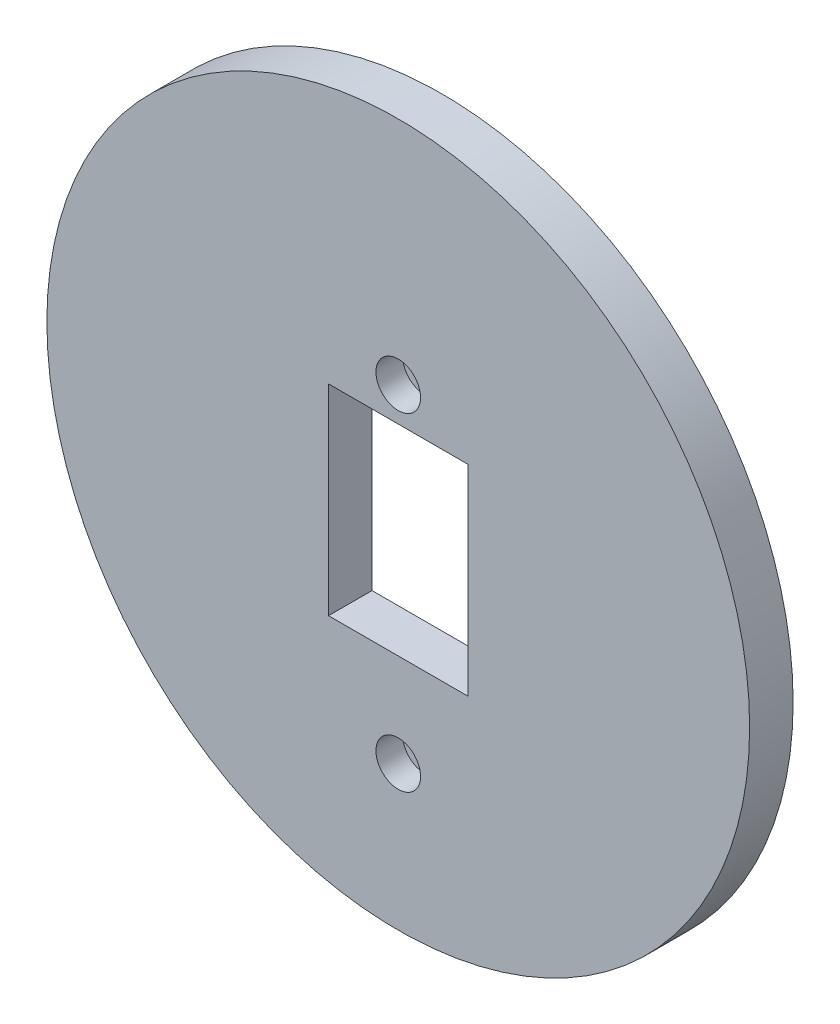
from build123d import *

# Parameters (mm, degrees)
CROQUIS1_R              = 31.5
SALIENTE_EXTRUIR1_DEPTH = 2.4
CROQUIS2_W              = 16.1
CROQUIS2_H              = 36.6
CROQUIS2_W_2            = 12.5
CROQUIS2_H_2            = 33
SALIENTE_EXTRUIR2_DEPTH = 22.5
CROQUIS5_W              = 16.1
CROQUIS5_H              = 36.6
CORTAR_EXTRUIR2_DEPTH   = 9
CROQUIS6_R              = 1.5
CORTAR_EXTRUIR3_DEPTH   = 2.4
CROQUIS7_W              = 12.5
CROQUIS7_H              = 9
SALIENTE_EXTRUIR3_DEPTH = 33
CROQUIS8_R              = 1
CORTAR_EXTRUIR5_DEPTH   = 9
SALIENTE_EXTRUIR4_DEPTH = 12.5
CROQUIS10_W             = 4
CROQUIS10_H             = 2
CORTAR_EXTRUIR6_DEPTH   = 9
CROQUIS11_R             = 31.5
CROQUIS11_W             = 12.5
CROQUIS11_H             = 18
SALIENTE_EXTRUIR5_DEPTH = 3.9
CORTAR_EXTRUIR7_START   = 7
CROQUIS12_R             = 1
CORTAR_EXTRUIR7_DEPTH   = 3.9
CROQUIS13_R             = 2
CORTAR_EXTRUIR8_DEPTH   = 2.4
CROQUIS14_R             = 31.5
CORTAR_EXTRUIR9_DEPTH   = 24.9


with BuildPart() as part:
    # Croquis1 → Saliente-Extruir1 (new body)
    with BuildSketch(Plane.XY):
        with Locations((-51.235671923, 9.786589019)):
            Circle(CROQUIS1_R)
    extrude(amount=SALIENTE_EXTRUIR1_DEPTH)

    # Croquis2 → Saliente-Extruir2 (add)
    with BuildSketch(Plane.XY.offset(2.4)):
        with Locations((-51.235671923, 6.086589019)):
            Rectangle(CROQUIS2_W, CROQUIS2_H)
        with Locations((-51.235671923, 6.086589019)):
            Rectangle(CROQUIS2_W_2, CROQUIS2_H_2, mode=Mode.SUBTRACT)
    extrude(amount=SALIENTE_EXTRUIR2_DEPTH)

    # Croquis5 → Cortar-Extruir2 (cut)
    with BuildSketch(Plane.XY.offset(2.4)):
        with Locations((-51.235671923, 6.086589019)):
            Rectangle(CROQUIS5_W, CROQUIS5_H)
    extrude(amount=-CORTAR_EXTRUIR2_DEPTH, mode=Mode.SUBTRACT)


with BuildPart() as cortar_extruir2_piece_1:
    # of the separate pieces the step leaves, piece 1, a body of its own (cortar_extruir2_pieces)
    add(part.part.solids().sort_by_distance((-19.735671923, 9.786589019, 0))[0])

    # Croquis6 → Cortar-Extruir3 (cut)
    with BuildSketch(Plane(origin=(0, 0, 0), x_dir=(-1, 0, 0), z_dir=(0, 0, -1))):
        with Locations((34.618662565, 26.403598377)):
            Circle(CROQUIS6_R)
        with Locations((67.85268128, 26.403598377)):
            Circle(CROQUIS6_R)
        with Locations((67.85268128, -6.830420339)):
            Circle(CROQUIS6_R)
        with Locations((34.618662565, -6.830420339)):
            Circle(CROQUIS6_R)
        Polygon((51.235671923, 24.386589019), (53.235671923, 24.386589019), (53.235671923, 44.386589019), (49.235671923, 44.386589019), (49.235671923, 24.386589019), align=None)
    extrude(amount=-CORTAR_EXTRUIR3_DEPTH, mode=Mode.SUBTRACT)


with BuildPart() as cortar_extruir2_piece_2:
    # of the separate pieces the step leaves, piece 2, a body of its own (cortar_extruir2_pieces)
    add(part.part.solids().sort_by_distance((-59.285671923, -12.213410981, 24.9))[0])

    # Croquis7 → Saliente-Extruir3 (add)
    with BuildSketch(Plane.XZ.offset(-22.586589019)):
        with Locations((-51.235671923, 13.4)):
            Rectangle(CROQUIS7_W, CROQUIS7_H)
    extrude(amount=SALIENTE_EXTRUIR3_DEPTH)

    # Croquis8 → Cortar-Extruir5 (cut)
    with BuildSketch(Plane.XY.offset(17.9)):
        with Locations((-51.235671923, -8.413410981)):
            Circle(CROQUIS8_R)
        with Locations((-51.235671923, 20.636589019)):
            Circle(CROQUIS8_R)
        Polygon((-44.985671923, -5.413410981), (-57.485671923, -5.413410981), (-57.485671923, 17.586589019), (-53.235671923, 17.586589019), (-53.235671923, 19.586589019), (-49.235671923, 19.586589019), (-49.235671923, 17.586589019), (-44.985671923, 17.586589019), align=None)
    extrude(amount=-CORTAR_EXTRUIR5_DEPTH, mode=Mode.SUBTRACT)

    # Croquis9 → Saliente-Extruir4 (add)
    with BuildSketch(Plane.ZY.offset(44.985671923)):
        Polygon((8.9, -5.413410981), (3.9, -10.413410981), (8.9, -10.413410981), align=None)
        Polygon((8.9, 17.586589019), (3.9, 22.586589019), (8.9, 22.586589019), align=None)
    extrude(amount=SALIENTE_EXTRUIR4_DEPTH)

    # Croquis10 → Cortar-Extruir6 (cut)
    with BuildSketch(Plane.XY.offset(8.9)):
        with Locations((-51.235671923, 18.586589019)):
            Rectangle(CROQUIS10_W, CROQUIS10_H)
    extrude(amount=-CORTAR_EXTRUIR6_DEPTH, mode=Mode.SUBTRACT)

    # Croquis11 → Saliente-Extruir5 (add)
    with BuildSketch(Plane.XY.offset(24.9)):
        with Locations((-51.235671923, 9.786589019)):
            Circle(CROQUIS11_R)
        with Locations((-51.235671923, 8.586589019)):
            Rectangle(CROQUIS11_W, CROQUIS11_H, mode=Mode.SUBTRACT)
    extrude(amount=SALIENTE_EXTRUIR5_DEPTH)

    # Croquis12 → Cortar-Extruir7 (cut)
    with BuildSketch(Plane.XY.offset(17.9).offset(CORTAR_EXTRUIR7_START)):
        with Locations((-51.235671923, 20.636589019)):
            Circle(CROQUIS12_R)
        with Locations((-51.235671923, -8.413410981)):
            Circle(CROQUIS12_R)
    extrude(amount=CORTAR_EXTRUIR7_DEPTH, mode=Mode.SUBTRACT)

    # Croquis13 → Cortar-Extruir8 (cut)
    with BuildSketch(Plane.XY.offset(28.8)):
        with Locations((-51.235671923, 20.636589019)):
            Circle(CROQUIS13_R)
        with Locations((-51.235671923, -8.771160787)):
            Circle(CROQUIS13_R)
    extrude(amount=-CORTAR_EXTRUIR8_DEPTH, mode=Mode.SUBTRACT)


with BuildPart() as cortar_extruir9_tool:
    # Croquis14 → Cortar-Extruir9 (new body)
    with BuildSketch(Plane(origin=(0, 0, 0), x_dir=(-1, 0, 0), z_dir=(0, 0, -1))):
        with Locations(Location((51.235671923, 9.786589019, 0), (0, 0, 180))):
            Circle(CROQUIS14_R)
    extrude(amount=-CORTAR_EXTRUIR9_DEPTH)


with BuildPart() as cortar_extruir2_piece_1_1:
    add(cortar_extruir2_piece_1.part)

    # Cortar-Extruir9: cut by cortar_extruir9_tool
    add(cortar_extruir9_tool.part, mode=Mode.SUBTRACT)


with BuildPart() as cortar_extruir2_piece_2_1:
    add(cortar_extruir2_piece_2.part)

    # Cortar-Extruir9: cut by cortar_extruir9_tool
    add(cortar_extruir9_tool.part, mode=Mode.SUBTRACT)


solid = cortar_extruir2_piece_2_1.part
